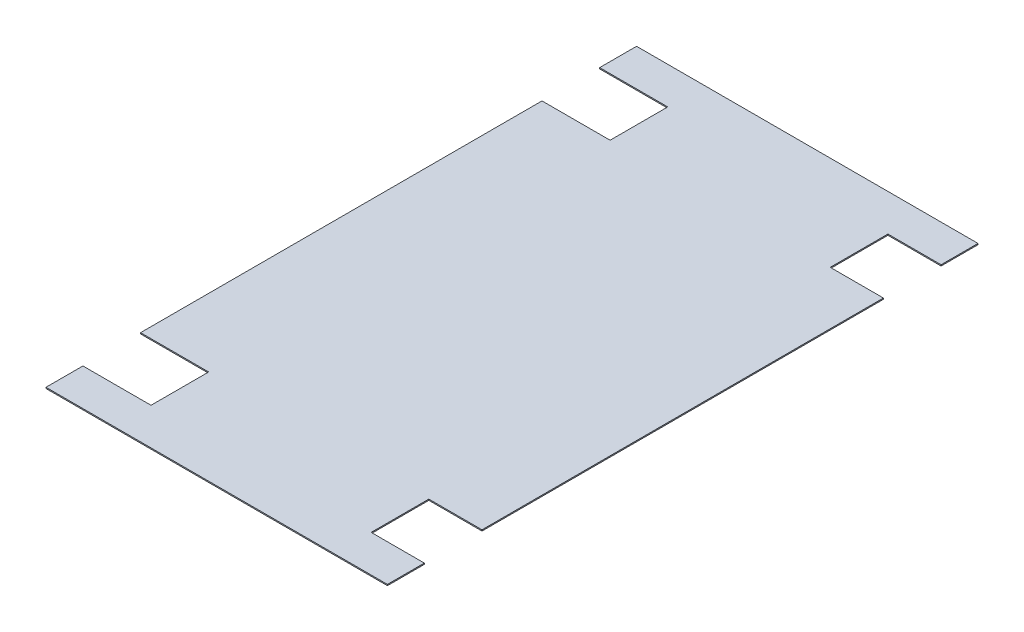
from build123d import *

# Parameters (mm, degrees)
SKETCH1_W           = 469.9
SKETCH1_H           = 812.8
BOSS_EXTRUDE1_DEPTH = 1.5875
SKETCH2_OUTSIDE_W   = 659.672
SKETCH2_OUTSIDE_H   = 1002.572
CUT_EXTRUDE1_DEPTH  = 1.5875


with BuildPart() as part:
    # Sketch1 → Boss-Extrude1 (new body)
    with BuildSketch(Plane(origin=(0, 0, 0), x_dir=(1, 0, 0), z_dir=(0, 1, 0))):
        Rectangle(SKETCH1_W, SKETCH1_H)
    extrude(amount=BOSS_EXTRUDE1_DEPTH)

    # Sketch2 outside → Cut-Extrude1 (cut)
    with BuildSketch(Plane(origin=(0, 1.5875, 0), x_dir=(1, 0, 0), z_dir=(0, 1, 0))):
        Rectangle(SKETCH2_OUTSIDE_W, SKETCH2_OUTSIDE_H)
        Polygon((-234.95, 355.6), (-234.95, 406.4), (234.95, 406.4), (234.95, 355.6), (161.769664855, 355.6), (161.769664855, 276.225), (234.95, 276.225), (234.95, -276.225), (161.769664855, -276.225), (161.769664855, -355.6), (234.95, -355.6), (234.95, -406.4), (-234.95, -406.4), (-234.95, -355.6), (-141.220731077, -355.6), (-141.220731077, -276.225), (-234.95, -276.225), (-234.95, 276.225), (-141.220731077, 276.225), (-141.220731077, 355.6), align=None, mode=Mode.SUBTRACT)
    extrude(amount=-CUT_EXTRUDE1_DEPTH, mode=Mode.SUBTRACT)


solid = part.part
